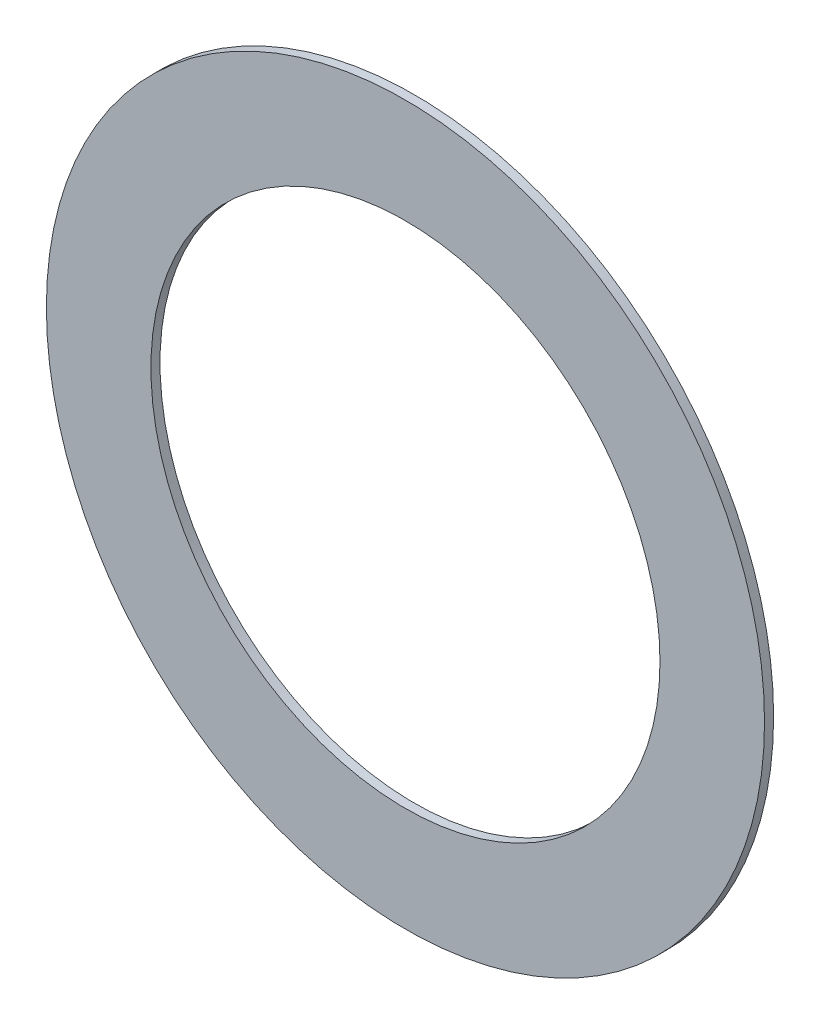
from build123d import *

# Parameters (mm, degrees)
ESQUISSE1_R          = 19.75
ESQUISSE1_R_2        = 14
BASE_EXTRUSION_DEPTH = 0.5


with BuildPart() as part:
    # Esquisse1 → Base-Extrusion (new body)
    with BuildSketch(Plane.XY):
        Circle(ESQUISSE1_R)
        Circle(ESQUISSE1_R_2, mode=Mode.SUBTRACT)
    extrude(amount=BASE_EXTRUSION_DEPTH)


solid = part.part
